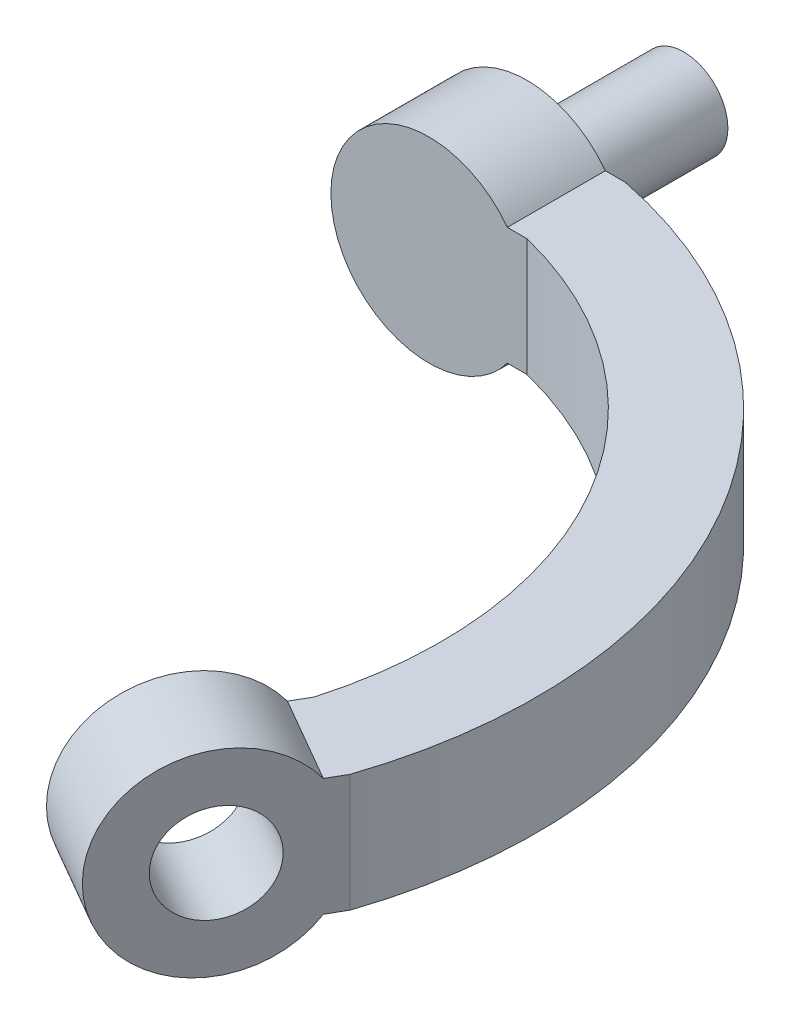
from build123d import *

# Parameters (mm, degrees)
SKETCH_2_R           = 5
EXTRUDE_3_DEPTH      = 5
EXTRUDE_4_DEPTH      = 3
EXTRUDE_4_DEPTH_BACK = 3
SKETCH_4_W           = 5
SKETCH_4_H           = 6
EXTRUDE_5_DEPTH      = 3
SKETCH_5_W           = 5
SKETCH_5_H           = 6
EXTRUDE_6_DEPTH      = 3
SKETCH_6_R           = 2.5
CUT_EXTRUDE_1_DEPTH  = 5
EXTRUDE_START        = -5
SKETCH_7_R           = 2.25
EXTRUDE_7_DEPTH      = 8


with BuildPart() as part:
    # 草图2 → 凸台-拉伸3 (new body)
    with BuildSketch(Plane.XY):
        Circle(SKETCH_2_R)
    extrude(amount=EXTRUDE_3_DEPTH)



with BuildPart() as body_2:
    # 草图3 → 凸台-拉伸4 (new, two sides: drawn at the far end of the back side and taken through both)
    with BuildSketch(Plane(origin=(0, 0, 0), x_dir=(1, 0, 0), z_dir=(0, 1, 0)).offset(-EXTRUDE_4_DEPTH_BACK)):
        with BuildLine():
            ThreePointArc((5, 0), (22.079402166, -12.252451216), (24.150635095, -33.169872981))
            Line((24.150635095, -33.169872981), (19.820508076, -30.669872981))
            ThreePointArc((19.820508076, -30.669872981), (17.853571071, -14.692235936), (5, -5))
            Line((5, -5), (5, 0))
        make_face()
    extrude(amount=EXTRUDE_4_DEPTH + EXTRUDE_4_DEPTH_BACK)



with BuildPart() as body_3:
    # 草图3<3> → 旋转1 (revolve)
    with BuildSketch(Plane(origin=(0, 0, 0), x_dir=(1, 0, 0), z_dir=(0, 1, 0)), mode=Mode.PRIVATE) as revolve_1_sk:
        Polygon((24.150635095, -33.169872981), (19.820508076, -30.669872981), (17.320508076, -35), (21.650635095, -37.5), align=None)
    revolve(revolve_1_sk.sketch.rotate(Axis((0, 0, 25), (0.8660254037844406, 0, 0.4999999999999967)), 180), axis=Axis((0, 0, 25), (0.8660254037844406, 0, 0.4999999999999967)))


with BuildPart() as body_2_1:
    add(body_2.part)

    add(body_3.part)  # 凸台-拉伸5 merges body 3
    # 草图4 → 凸台-拉伸5 (add)
    with BuildSketch(Plane(origin=(-8.325317547, 0, 14.419872981), x_dir=(0.8660254037844396, 0, 0.49999999999999856), z_dir=(-0.49999999999999856, 0, 0.8660254037844396))):
        with Locations((35, 0)):
            Rectangle(SKETCH_4_W, SKETCH_4_H)
    extrude(amount=EXTRUDE_5_DEPTH)


with BuildPart() as part_1:
    add(part.part)

    add(body_2_1.part)  # 凸台-拉伸6 merges body 2
    # 草图5 → 凸台-拉伸6 (add)
    with BuildSketch(Plane.ZY.offset(-5)):
        with Locations((2.5, 0)):
            Rectangle(SKETCH_5_W, SKETCH_5_H)
    extrude(amount=EXTRUDE_6_DEPTH)

    # 草图6 → 切除-拉伸1 (cut)
    with BuildSketch(Plane(origin=(28.145825623, 0, 16.25), x_dir=(-0.49999999999999856, 0, 0.8660254037844396), z_dir=(-0.8660254037844396, 0, -0.49999999999999856))):
        with Locations((21.650635095, 0)):
            Circle(SKETCH_6_R)
    extrude(amount=-CUT_EXTRUDE_1_DEPTH, mode=Mode.SUBTRACT)

    # 草图7 → 凸台-拉伸7 (add)
    with BuildSketch(Plane.XY.offset(5).offset(EXTRUDE_START)):
        Circle(SKETCH_7_R)
    extrude(amount=-EXTRUDE_7_DEPTH)


solid = part_1.part
